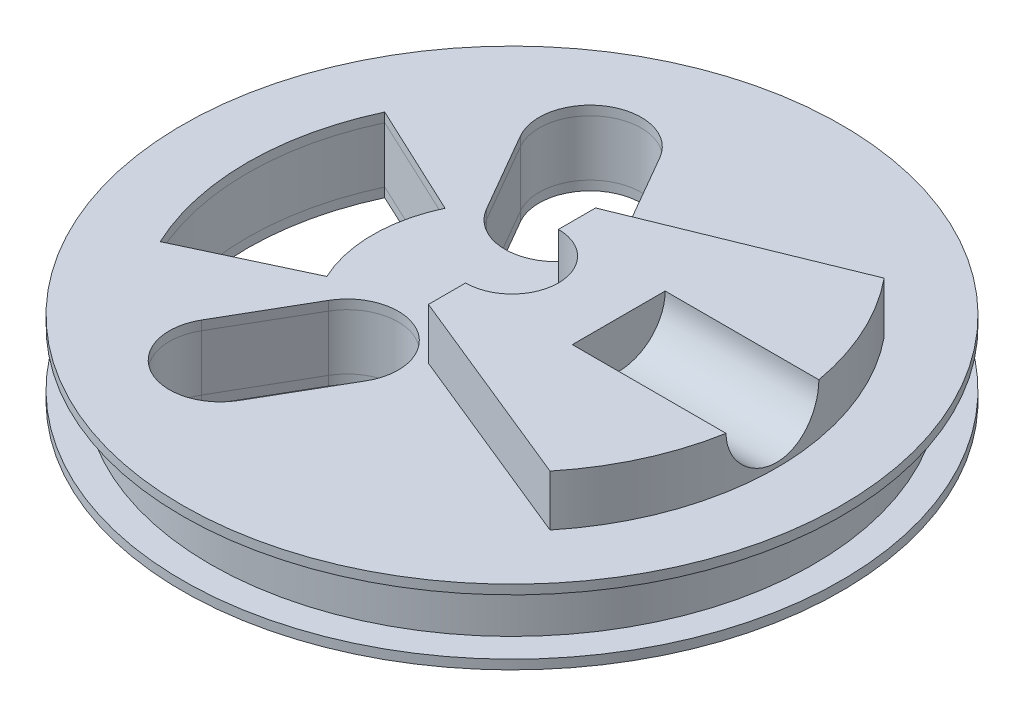
from build123d import *

# Parameters (mm, degrees)
SKETCH1_R               = 32.5
SKETCH1_R_2             = 5
BOSS_EXTRUDE1_DEPTH     = 6
BOSS_EXTRUDE3_DEPTH     = 6.5
SKETCH6_R               = 5
CUT_EXTRUDE1_DEPTH      = 17
SKETCH11_R              = 35.5
BOSS_EXTRUDE4_DEPTH     = 1
SKETCH12_R              = 35.5
BOSS_EXTRUDE5_DEPTH     = 1
CUT_EXTRUDE4_DEPTH      = 51.690235746
CUT_EXTRUDE4_DEPTH_BACK = 51.690235746
CUT_EXTRUDE5_DEPTH      = 51.690235746
CUT_EXTRUDE5_DEPTH_BACK = 51.690235746


with BuildPart() as part:
    # Sketch1 → Boss-Extrude1 (new body)
    with BuildSketch(Plane(origin=(0, 0, 0), x_dir=(1, 0, 0), z_dir=(0, 1, 0))):
        with Locations(Location((0, 0, 0), (0, 0, 270))):
            Circle(SKETCH1_R)
        with Locations(Location((0, 0, 0), (0, 0, 270))):
            Circle(SKETCH1_R_2, mode=Mode.SUBTRACT)
    extrude(amount=BOSS_EXTRUDE1_DEPTH)

    # Sketch5 → Boss-Extrude3 (add)
    with BuildSketch(Plane(origin=(0, 6, 0), x_dir=(1, 0, 0), z_dir=(0, 1, 0))):
        with BuildLine():
            Line((0, 9), (22.096379794, 18))
            ThreePointArc((22.096379794, 18), (28.5, 0), (22.096379794, -18))
            Line((22.096379794, -18), (0, -9))
            Line((0, -9), (0, -5))
            ThreePointArc((0, -5), (5, 0), (0, 5))
            Line((0, 5), (0, 9))
        make_face()
    extrude(amount=BOSS_EXTRUDE3_DEPTH)

    # Sketch6 → Cut-Extrude1 (cut)
    with BuildSketch(Plane(origin=(28.5, 0, 0), x_dir=(0, 0, -1), z_dir=(1, 0, 0))):
        with Locations((0, 12.5)):
            Circle(SKETCH6_R)
    extrude(amount=-CUT_EXTRUDE1_DEPTH, mode=Mode.SUBTRACT)


with BuildPart() as body_2:
    # Sketch11 → Boss-Extrude4 (new body)
    with BuildSketch(Plane(origin=(0, 6, 0), x_dir=(1, 0, 0), z_dir=(0, 1, 0))):
        with Locations(Location((0, 0, 0), (0, 0, 270))):
            Circle(SKETCH11_R)
    extrude(amount=BOSS_EXTRUDE4_DEPTH)


with BuildPart() as body_3:
    # Sketch12 → Boss-Extrude5 (new body)
    with BuildSketch(Plane.XZ):
        with Locations(Location((0, 0, 0), (0, 0, 270))):
            Circle(SKETCH12_R)
    extrude(amount=BOSS_EXTRUDE5_DEPTH)


with BuildPart() as cut_extrude4_tool:
    # Sketch10 → Cut-Extrude4 (new, two sides: drawn at the far end of the back side and taken through both)
    with BuildSketch(Plane(origin=(0, 6, 0), x_dir=(1, 0, 0), z_dir=(0, 1, 0)).offset(-CUT_EXTRUDE4_DEPTH_BACK)):
        with BuildLine():
            Line((-13.582072734, 6.366105579), (-25.804414899, 12.094886611))
            ThreePointArc((-25.804414899, 12.094886611), (-28.498317677, 0), (-25.804414899, -12.094886611))
            Line((-25.804414899, -12.094886611), (-13.582072734, -6.366105579))
            ThreePointArc((-13.582072734, -6.366105579), (-15, 0), (-13.582072734, 6.366105579))
        make_face()
    extrude(amount=CUT_EXTRUDE4_DEPTH + CUT_EXTRUDE4_DEPTH_BACK)


with BuildPart() as part_1:
    add(part.part)

    # Cut-Extrude4: cut by cut_extrude4_tool
    add(cut_extrude4_tool.part, mode=Mode.SUBTRACT)


with BuildPart() as body_2_1:
    add(body_2.part)

    # Cut-Extrude4: cut by cut_extrude4_tool
    add(cut_extrude4_tool.part, mode=Mode.SUBTRACT)


with BuildPart() as body_3_1:
    add(body_3.part)

    # Cut-Extrude4: cut by cut_extrude4_tool
    add(cut_extrude4_tool.part, mode=Mode.SUBTRACT)


with BuildPart() as cut_extrude5_tool:
    # Sketch8 → Cut-Extrude5 (new, two sides: drawn at the far end of the back side and taken through both)
    with BuildSketch(Plane(origin=(0, 6, 0), x_dir=(1, 0, 0), z_dir=(0, 1, 0)).offset(-CUT_EXTRUDE5_DEPTH_BACK)):
        with BuildLine():
            Line((-6.736860279, 22.668584287), (-1.736860279, 14.008330249))
            ThreePointArc((-1.736860279, 14.008330249), (-3.75, 6.495190528), (-11.263139721, 8.508330249))
            Line((-11.263139721, 8.508330249), (-16.263139721, 17.168584287))
            ThreePointArc((-16.263139721, 17.168584287), (-14.25, 24.681724008), (-6.736860279, 22.668584287))
        make_face()
        with BuildLine():
            Line((-6.736860279, -22.668584287), (-1.736860279, -14.008330249))
            ThreePointArc((-1.736860279, -14.008330249), (-3.75, -6.495190528), (-11.263139721, -8.508330249))
            Line((-11.263139721, -8.508330249), (-16.263139721, -17.168584287))
            ThreePointArc((-16.263139721, -17.168584287), (-14.25, -24.681724008), (-6.736860279, -22.668584287))
        make_face()
    extrude(amount=CUT_EXTRUDE5_DEPTH + CUT_EXTRUDE5_DEPTH_BACK)


with BuildPart() as part_2:
    add(part_1.part)

    # Cut-Extrude5: cut by cut_extrude5_tool
    add(cut_extrude5_tool.part, mode=Mode.SUBTRACT)


with BuildPart() as body_2_2:
    add(body_2_1.part)

    # Cut-Extrude5: cut by cut_extrude5_tool
    add(cut_extrude5_tool.part, mode=Mode.SUBTRACT)


with BuildPart() as body_3_2:
    add(body_3_1.part)

    # Cut-Extrude5: cut by cut_extrude5_tool
    add(cut_extrude5_tool.part, mode=Mode.SUBTRACT)


solid = Compound([part_2.part, body_2_2.part, body_3_2.part])
